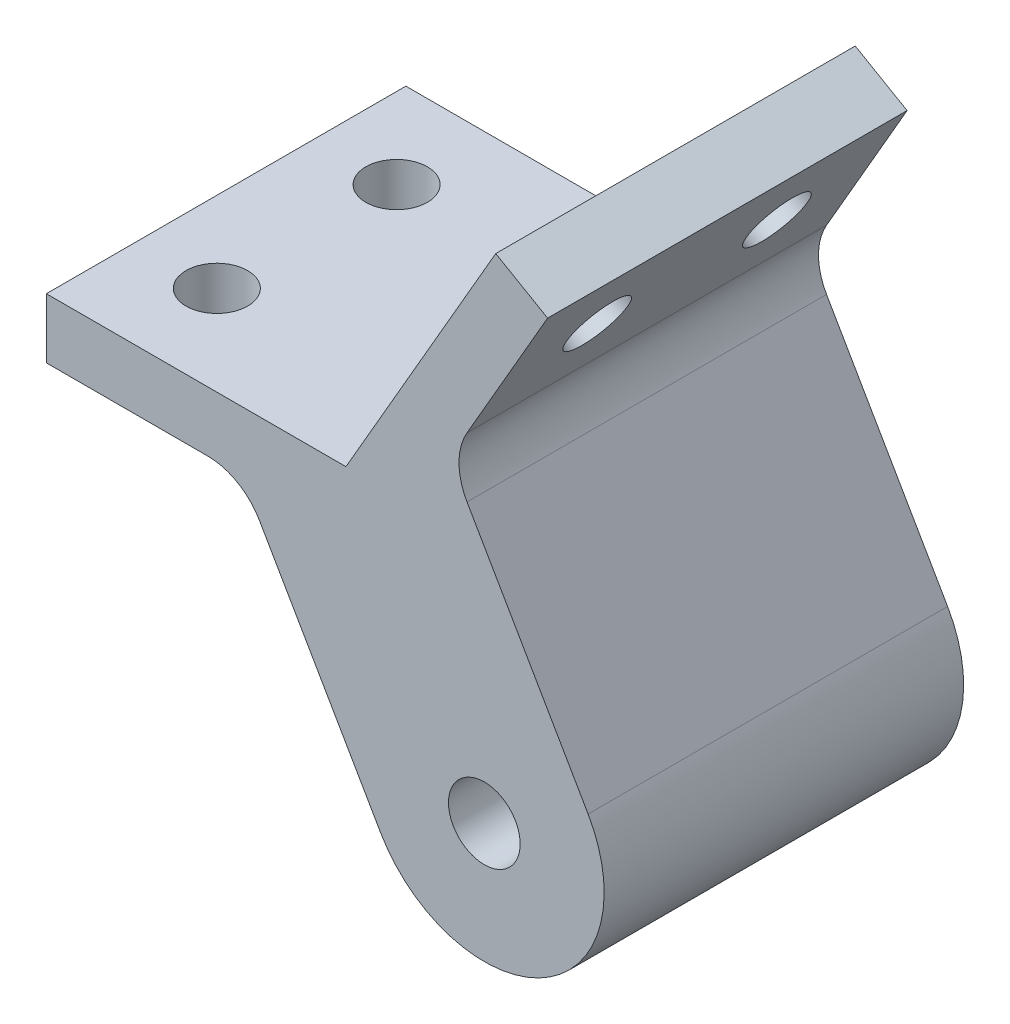
from build123d import *

# Parameters (mm, degrees)
BOSS_EXTRUDE1_DEPTH     = 19.05
F_6_CLEARANCE_HOLE1_D   = 3.7973
FILLET1_R               = 3.175
E_0_25_DIAMETER_HOLE1_D = 3.2639
E_0_25_DIAMETER_HOLE2_D = 3.2639


with BuildPart() as part:
    # Sketch1 → Boss-Extrude1 (new body)
    with BuildSketch(Plane.XY):
        with BuildLine():
            Line((-7.332348419, 12.7), (0.605151581, 26.448153285))
            Line((0.605151581, 26.448153285), (3.354782238, 24.860653285))
            Line((3.354782238, 24.860653285), (-1.833087105, 15.875))
            Line((-1.833087105, 15.875), (5.499261314, 3.175))
            ThreePointArc((5.499261314, 3.175), (3.175, -5.499261314), (-5.499261314, -3.175))
            Line((-5.499261314, -3.175), (-12.831609733, 9.525))
            Line((-12.831609733, 9.525), (-23.207348419, 9.525))
            Line((-23.207348419, 9.525), (-23.207348419, 12.7))
            Line((-23.207348419, 12.7), (-7.332348419, 12.7))
        make_face()
    extrude(amount=BOSS_EXTRUDE1_DEPTH)

    # #6 Clearance Hole1 (through all)
    with Locations(Plane(origin=(0, 0, 0), x_dir=(-1, 0, 0), z_dir=(0, 0, -1))):
        with Locations((0, 0)):
            Hole(F_6_CLEARANCE_HOLE1_D / 2)

    # Fillet1
    fillet1_edges = [part.edges().sort_by_distance(p)[0] for p in [
        (-1.833087105, 15.875, 9.525),
        (-12.831609733, 9.525, 9.525),
    ]]
    fillet(fillet1_edges, radius=FILLET1_R)

    # E (0.25) Diameter Hole1 (through all)
    with Locations(Plane(origin=(-8.248891971, 4.7625, 0), x_dir=(0, 0, -1), z_dir=(0.86602540378444, -0.49999999999999784, 0))):
        with Locations((-4.7625, 18.936022628), (-14.2875, 18.936022628)):
            Hole(E_0_25_DIAMETER_HOLE1_D / 2)

    # E (0.25) Diameter Hole2 (through all)
    with Locations(Plane(origin=(-18.936022628, 9.525, 14.2875), x_dir=(-1, 0, 0), z_dir=(0, -1, 0))):
        with Locations((0, 0), (0, 9.525)):
            Hole(E_0_25_DIAMETER_HOLE2_D / 2)


solid = part.part
